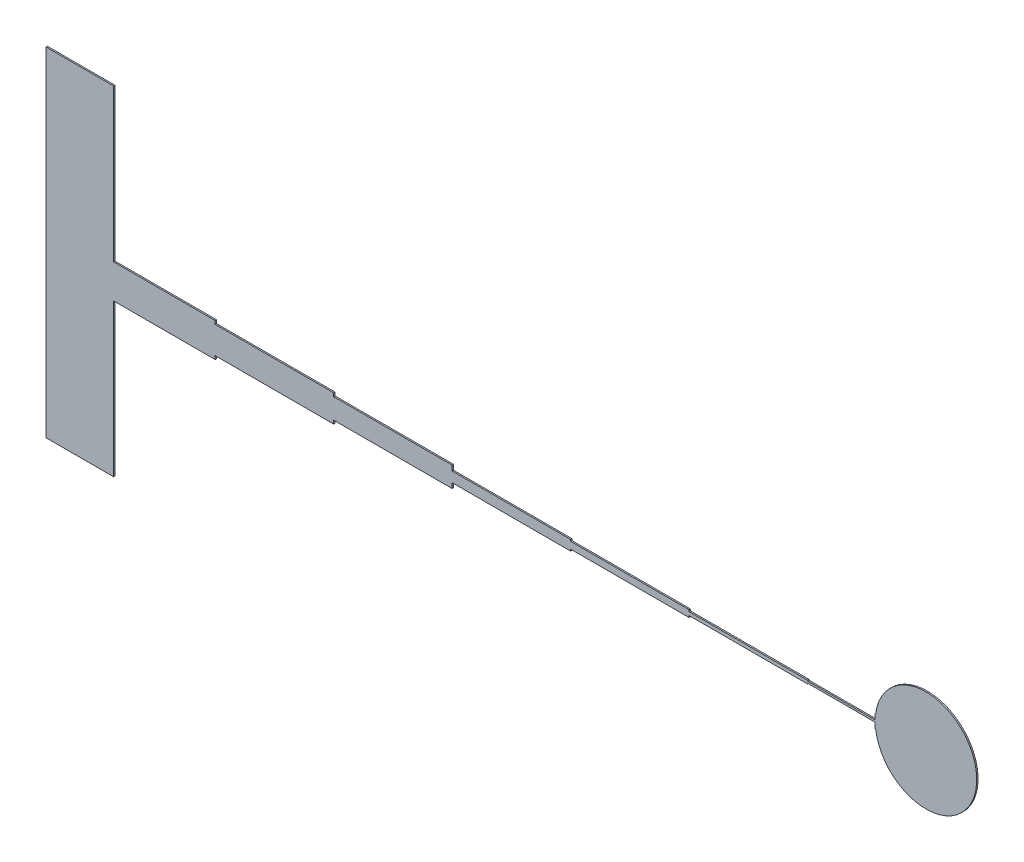
from build123d import *

# Parameters (mm, degrees)
BOSS_EXTRUDE1_DEPTH = 20
SKETCH2_W           = 1000
SKETCH2_H           = 2250
CUT_EXTRUDE1_DEPTH  = 12993.801853334
CUT_EXTRUDE4_DEPTH  = 12993.801853334
SKETCH4_W           = 1750
SKETCH4_H           = 50
CUT_EXTRUDE5_DEPTH  = 12993.801853334
SKETCH5_W           = 1750
SKETCH5_H           = 75
CUT_EXTRUDE6_DEPTH  = 12993.801853334
SKETCH6_W           = 1750
SKETCH6_H           = 100
CUT_EXTRUDE7_DEPTH  = 12993.801853334
SKETCH7_W           = 1000
SKETCH7_H           = 85
CUT_EXTRUDE8_DEPTH  = 12993.801853334


with BuildPart() as part:
    # Sketch1 → Boss-Extrude1 (new body)
    with BuildSketch(Plane.XY):
        with BuildLine():
            Line((1000, 250), (5000, 250))
            Line((5000, 250), (5000, 125))
            Line((5000, 125), (9000, 125))
            Line((9000, 125), (9000, 100))
            Line((9000, 100), (11256.696562634, 100))
            ThreePointArc((11256.696562634, 100), (12750, 0), (11256.696562634, -100))
            Line((11256.696562634, -100), (9000, -100))
            Line((9000, -100), (9000, -125))
            Line((9000, -125), (5000, -125))
            Line((5000, -125), (5000, -250))
            Line((5000, -250), (1000, -250))
            Line((1000, -250), (1000, -2500))
            Line((1000, -2500), (-1000, -2500))
            Line((-1000, -2500), (-1000, 2500))
            Line((-1000, 2500), (1000, 2500))
            Line((1000, 2500), (1000, 250))
        make_face()
    extrude(amount=-BOSS_EXTRUDE1_DEPTH)

    # Sketch2 → Cut-Extrude1 (cut, through all)
    with BuildSketch(Plane.XY):
        with Locations((500, 1375)):
            Rectangle(SKETCH2_W, SKETCH2_H)
        with Locations((500, -1375)):
            Rectangle(SKETCH2_W, SKETCH2_H)
    extrude(amount=-CUT_EXTRUDE1_DEPTH, mode=Mode.SUBTRACT)

    # Sketch3 → Cut-Extrude4 (cut, through all)
    with BuildSketch(Plane.XY):
        Polygon((1500, -250), (3250, -250), (5000, -250), (5000, -150), (3250, -150), (3250, -200), (1500, -200), align=None)
    cut_extrude4 = extrude(amount=-CUT_EXTRUDE4_DEPTH, mode=Mode.SUBTRACT)

    # Mirror1: Cut-Extrude4 across plane
    add(cut_extrude4.mirror(Plane.ZX), mode=Mode.SUBTRACT)

    # Sketch4 → Cut-Extrude5 (cut, through all)
    with BuildSketch(Plane.XY):
        with Locations((5875, 100)):
            Rectangle(SKETCH4_W, SKETCH4_H)
    cut_extrude5 = extrude(amount=-CUT_EXTRUDE5_DEPTH, mode=Mode.SUBTRACT)

    # Mirror2: Cut-Extrude5 across plane
    add(cut_extrude5.mirror(Plane.ZX), mode=Mode.SUBTRACT)

    # Sketch5 → Cut-Extrude6 (cut, through all)
    with BuildSketch(Plane.XY):
        with Locations((7625, 87.5)):
            Rectangle(SKETCH5_W, SKETCH5_H)
    cut_extrude6 = extrude(amount=-CUT_EXTRUDE6_DEPTH, mode=Mode.SUBTRACT)

    # Mirror3: Cut-Extrude6 across plane
    add(cut_extrude6.mirror(Plane.ZX), mode=Mode.SUBTRACT)

    # Sketch6 → Cut-Extrude7 (cut, through all)
    with BuildSketch(Plane.XY):
        with Locations((9375, 75)):
            Rectangle(SKETCH6_W, SKETCH6_H)
    cut_extrude7 = extrude(amount=-CUT_EXTRUDE7_DEPTH, mode=Mode.SUBTRACT)

    # Mirror4: Cut-Extrude7 across plane
    add(cut_extrude7.mirror(Plane.ZX), mode=Mode.SUBTRACT)

    # Sketch7 → Cut-Extrude8 (cut, through all)
    with BuildSketch(Plane.XY):
        with Locations((10750, 57.5)):
            Rectangle(SKETCH7_W, SKETCH7_H)
    cut_extrude8 = extrude(amount=-CUT_EXTRUDE8_DEPTH, mode=Mode.SUBTRACT)

    # Mirror5: Cut-Extrude8 across plane
    add(cut_extrude8.mirror(Plane.ZX), mode=Mode.SUBTRACT)


solid = part.part
